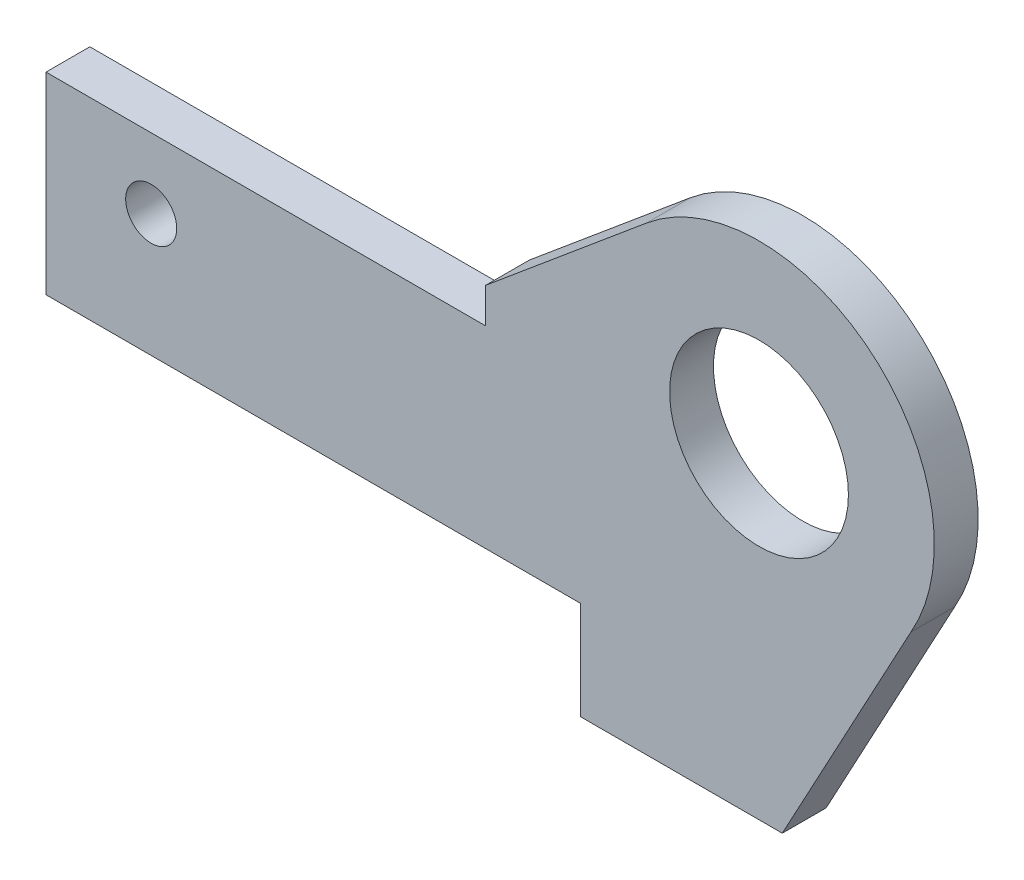
from build123d import *

# Parameters (mm, degrees)
SKETCH1_R                = 6.477
BOSS_EXTRUDE1_DEPTH      = 3.175
CUT_EXTRUDE1_REACH       = 71.794
SKETCH2_W                = 36.544437467
SKETCH2_H                = 39.878
SKETCH3_W                = 3.175
SKETCH3_H                = 13.97
BOSS_EXTRUDE2_DEPTH      = 22.86
M3_CLEARANCE_HOLE1_D     = 3.7
M3_CLEARANCE_HOLE1_DEPTH = 25.4
M3_CLEARANCE_HOLE1_TIP   = 1.111592145
SKETCH7_W                = 3.175
SKETCH7_H                = 7.112
CUT_EXTRUDE2_DEPTH       = 15.875


with BuildPart() as part:
    # Sketch1 → Boss-Extrude1 (new body)
    with BuildSketch(Plane.XY):
        with BuildLine():
            Line((-8.141025641, 9.747497192), (-19.812, 0))
            Line((-19.812, 0), (-19.812, -2.54))
            Line((-19.812, -2.54), (-28.7909, -2.54))
            Line((-28.7909, -2.54), (-28.7909, -63.5))
            Line((-28.7909, -63.5), (-19.812, -63.5))
            Line((-19.812, -63.5), (10.998522628, -6.35))
            ThreePointArc((10.998522628, -6.35), (8.174574987, 9.719378775), (-8.141025641, 9.747497192))
        make_face()
        Circle(SKETCH1_R, mode=Mode.SUBTRACT)
    extrude(amount=BOSS_EXTRUDE1_DEPTH)

    # Sketch2 → Cut-Extrude1 (cut, up to next)
    with BuildSketch(Plane.XY.offset(3.175), mode=Mode.PRIVATE) as cut_extrude1_sk1:
        with Locations((-10.518681266, -43.561)):
            Rectangle(SKETCH2_W, SKETCH2_H)
    cut_extrude1_tool1 = extrude(cut_extrude1_sk1.sketch, amount=-CUT_EXTRUDE1_REACH, mode=Mode.PRIVATE) & part.part
    add(cut_extrude1_tool1.solids().sort_by_distance((-10.518681, -43.561, 3.175))[0], mode=Mode.SUBTRACT)

    # Sketch3 → Boss-Extrude2 (add)
    with BuildSketch(Plane.ZY.offset(28.7909)):
        with Locations((1.5875, -9.525)):
            Rectangle(SKETCH3_W, SKETCH3_H)
    extrude(amount=BOSS_EXTRUDE2_DEPTH)

    # M3 Clearance Hole1
    with Locations(Plane(origin=(0, 0, 0), x_dir=(-1, 0, 0), z_dir=(0, 0, -1))):
        with Locations((44.0309, -7.62)):
            Hole(M3_CLEARANCE_HOLE1_D / 2, depth=M3_CLEARANCE_HOLE1_DEPTH)
            with Locations((0, 0, -(M3_CLEARANCE_HOLE1_DEPTH + M3_CLEARANCE_HOLE1_TIP / 2))):  # 118° drill point
                Cone(0, M3_CLEARANCE_HOLE1_D / 2, M3_CLEARANCE_HOLE1_TIP, mode=Mode.SUBTRACT)

    # Sketch7 → Cut-Extrude2 (cut)
    with BuildSketch(Plane.ZY.offset(28.7909)):
        with Locations((1.5875, -20.066)):
            Rectangle(SKETCH7_W, SKETCH7_H)
    extrude(amount=-CUT_EXTRUDE2_DEPTH, mode=Mode.SUBTRACT)


solid = part.part
